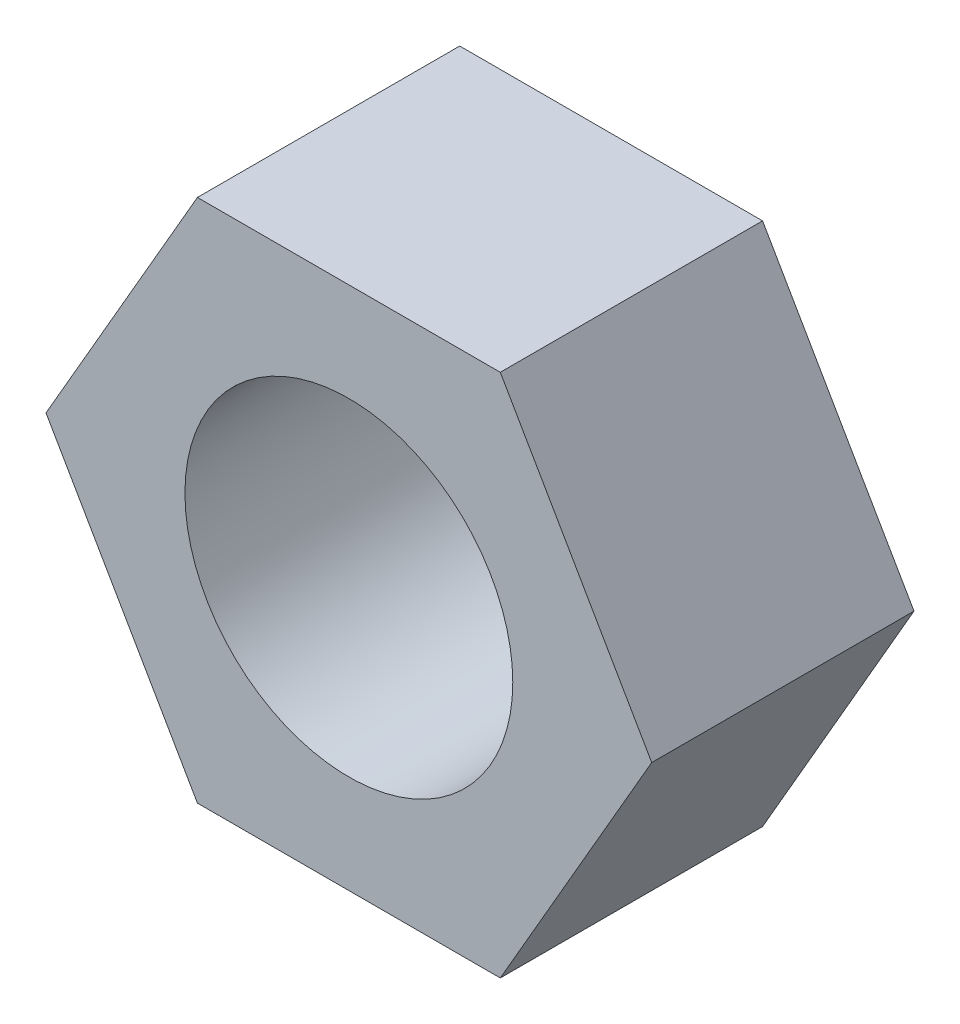
from build123d import *

# Parameters (mm, degrees)
CROQUIS1_R              = 2.5
SALIENTE_EXTRUIR1_DEPTH = 4


with BuildPart() as part:
    # Croquis1 → Saliente-Extruir1 (new body)
    with BuildSketch(Plane.XY):
        Polygon((4.618802154, 0), (2.309401077, 4), (-2.309401077, 4), (-4.618802154, 0), (-2.309401077, -4), (2.309401077, -4), align=None)
        Circle(CROQUIS1_R, mode=Mode.SUBTRACT)
    extrude(amount=SALIENTE_EXTRUIR1_DEPTH)


solid = part.part
